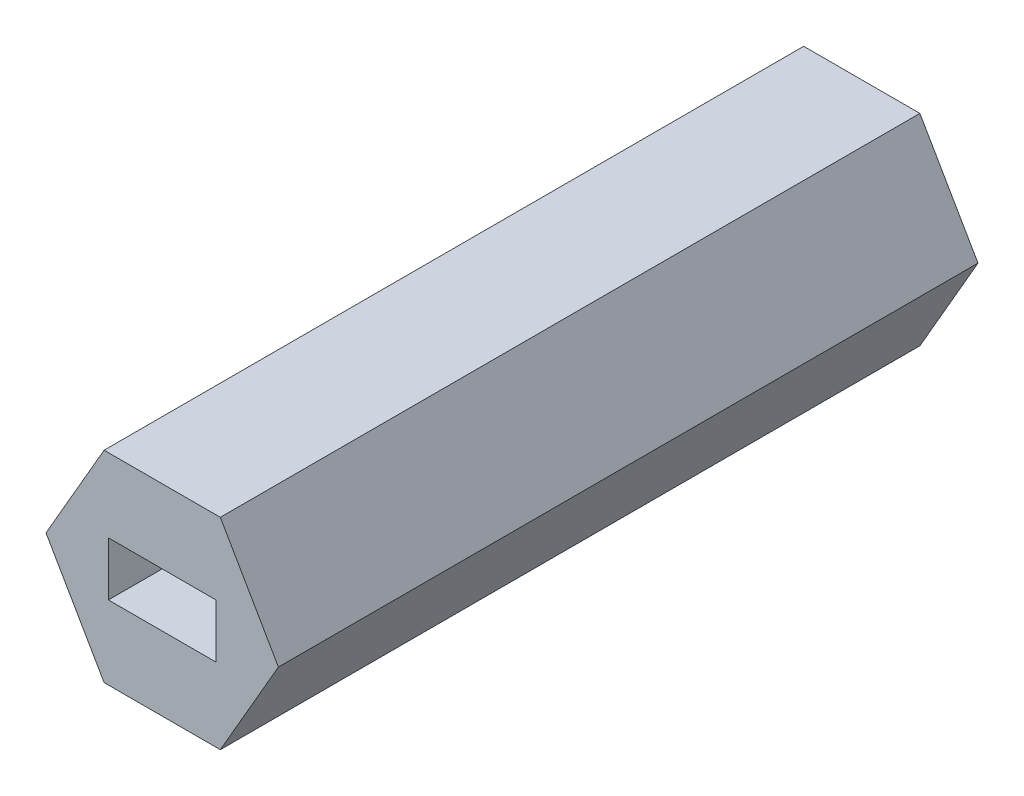
from build123d import *

# Parameters (mm, degrees)
SKETCH1_W           = 5.08
SKETCH1_H           = 2.54
BOSS_EXTRUDE1_DEPTH = 33.02


with BuildPart() as part:
    # Sketch1 → Boss-Extrude1 (new body)
    with BuildSketch(Plane.XY):
        Polygon((-2.742413779, 4.75), (-5.484827557, 0), (-2.742413779, -4.75), (2.742413779, -4.75), (5.484827557, 0), (2.742413779, 4.75), align=None)
        Rectangle(SKETCH1_W, SKETCH1_H, mode=Mode.SUBTRACT)
    extrude(amount=BOSS_EXTRUDE1_DEPTH)


solid = part.part
